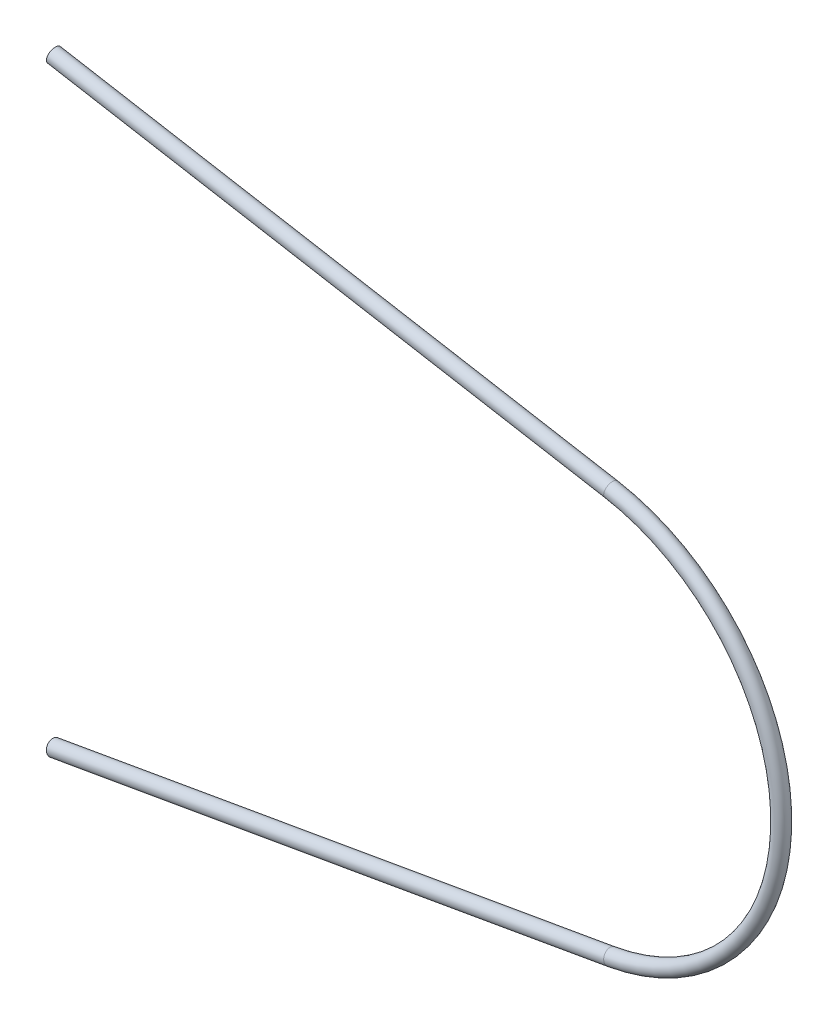
from build123d import *

# Parameters (mm, degrees)
SKETCH12_R = 1.5


with BuildPart() as part:
    # RoundBeltSweep: sweep along a path in Sketch2<2>
    with BuildLine(Plane.XY) as roundbeltsweep_path:
        Line((-105.655172414, -59.10147665), (6.896551724, -39.400984433))
        ThreePointArc((6.896551724, -39.400984433), (40, 0), (6.896551724, 39.400984433))
        Line((6.896551724, 39.400984433), (-105.655172414, 59.10147665))
    # Sketch12 → RoundBeltSweep (sweep)
    with BuildSketch(Plane(origin=(0, 0, 0), x_dir=(0, 0, -1), z_dir=(0, 1, 0))):
        with Locations((0, -41.5)):
            Circle(SKETCH12_R)
    sweep(path=roundbeltsweep_path.line)


solid = part.part
